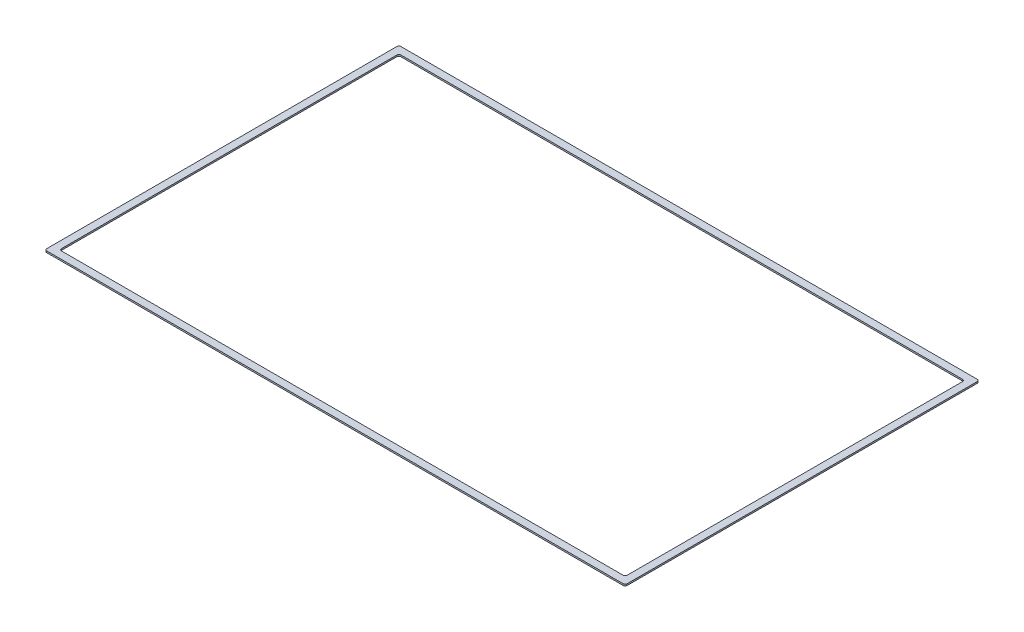
from build123d import *

# Parameters (mm, degrees)
SKETCH1_W           = 554
SKETCH1_H           = 338
SKETCH1_W_2         = 540
SKETCH1_H_2         = 324
BOSS_EXTRUDE1_DEPTH = 1.5
FILLET1_R           = 2


with BuildPart() as part:
    # Sketch1 → Boss-Extrude1 (new body)
    with BuildSketch(Plane(origin=(0, 0, 0), x_dir=(1, 0, 0), z_dir=(0, 1, 0))):
        Rectangle(SKETCH1_W, SKETCH1_H)
        Rectangle(SKETCH1_W_2, SKETCH1_H_2, mode=Mode.SUBTRACT)
    extrude(amount=BOSS_EXTRUDE1_DEPTH)

    # Fillet1
    fillet1_edges = [part.edges().sort_by_distance(p)[0] for p in [
        (-270, 0.75, -162),
        (-270, 0.75, 162),
        (270, 0.75, 162),
        (270, 0.75, -162),
        (-277, 0.75, -169),
        (277, 0.75, -169),
        (277, 0.75, 169),
        (-277, 0.75, 169),
    ]]
    fillet(fillet1_edges, radius=FILLET1_R)


solid = part.part
